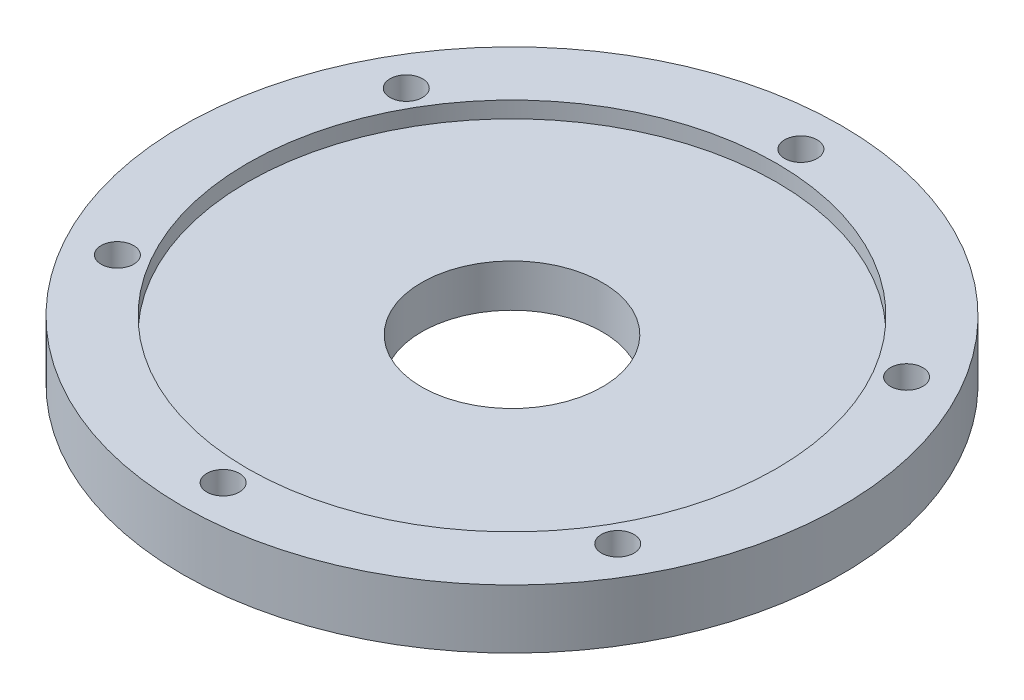
from build123d import *

# Parameters (mm, degrees)
SKETCH1_R           = 81
SKETCH1_R_2         = 22.225
SKETCH1_R_3         = 4
BOSS_EXTRUDE1_DEPTH = 14.5
SKETCH2_R           = 65
CUT_EXTRUDE1_DEPTH  = 4


with BuildPart() as part:
    # Sketch1 → Boss-Extrude1 (new body)
    with BuildSketch(Plane(origin=(0, 0, 0), x_dir=(1, 0, 0), z_dir=(0, 1, 0))):
        with Locations(Location((0, 0, 0), (0, 0, 270))):
            Circle(SKETCH1_R)
        with Locations(Location((0, 0, 0), (0, 0, 270))):
            Circle(SKETCH1_R_2, mode=Mode.SUBTRACT)
        with Locations(Location((0, 71, 0), (0, 0, 270))):
            Circle(SKETCH1_R_3, mode=Mode.SUBTRACT)
        with Locations(Location((61.487803669, 35.5, 0), (0, 0, 270))):
            Circle(SKETCH1_R_3, mode=Mode.SUBTRACT)
        with Locations(Location((61.487803669, -35.5, 0), (0, 0, 270))):
            Circle(SKETCH1_R_3, mode=Mode.SUBTRACT)
        with Locations(Location((0, -71, 0), (0, 0, 270))):
            Circle(SKETCH1_R_3, mode=Mode.SUBTRACT)
        with Locations(Location((-61.487803669, -35.5, 0), (0, 0, 270))):
            Circle(SKETCH1_R_3, mode=Mode.SUBTRACT)
        with Locations(Location((-61.487803669, 35.5, 0), (0, 0, 270))):
            Circle(SKETCH1_R_3, mode=Mode.SUBTRACT)
    extrude(amount=-BOSS_EXTRUDE1_DEPTH)

    # Sketch2 → Cut-Extrude1 (cut)
    with BuildSketch(Plane(origin=(0, 0, 0), x_dir=(1, 0, 0), z_dir=(0, 1, 0))):
        with Locations(Location((0, 0, 0), (0, 0, 270))):
            Circle(SKETCH2_R)
    extrude(amount=-CUT_EXTRUDE1_DEPTH, mode=Mode.SUBTRACT)


solid = part.part
